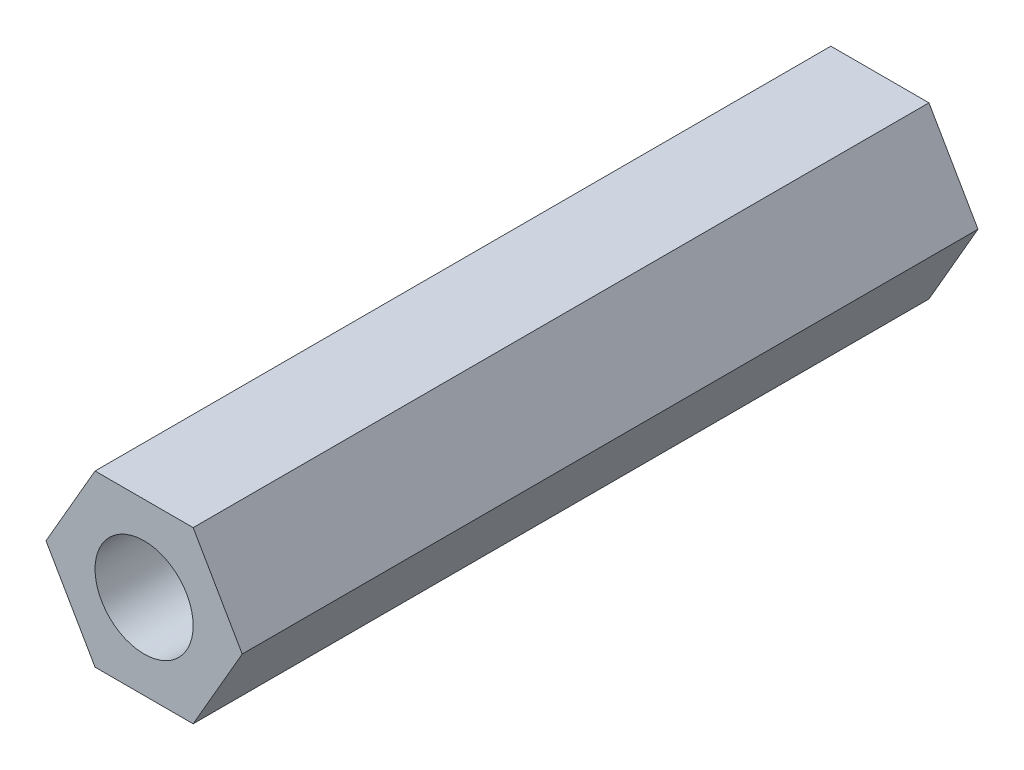
from build123d import *

# Parameters (mm, degrees)
SKETCH_1_R      = 2
EXTRUDE_1_DEPTH = 30


with BuildPart() as part:
    # 草图1 → 凸台-拉伸1 (new body)
    with BuildSketch(Plane.XY):
        Polygon((-2, 3.464101615), (-4, 0), (-2, -3.464101615), (2, -3.464101615), (4, 0), (2, 3.464101615), align=None)
        Circle(SKETCH_1_R, mode=Mode.SUBTRACT)
    extrude(amount=EXTRUDE_1_DEPTH)


solid = part.part
